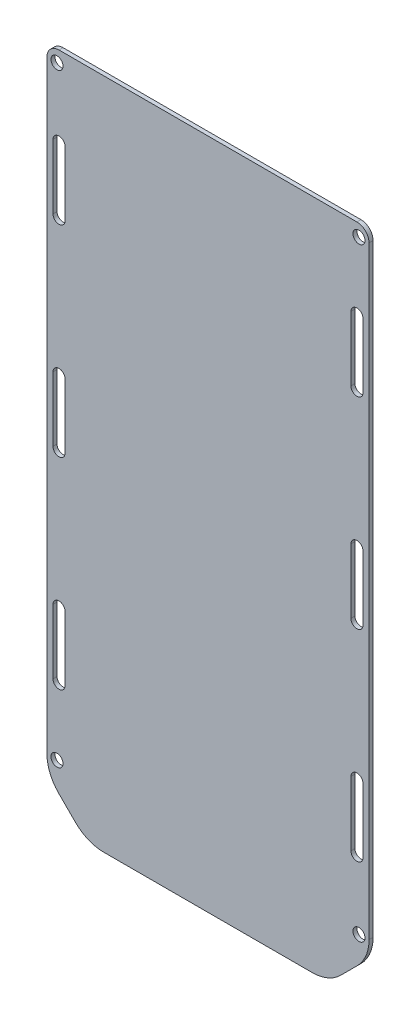
from build123d import *

# Parameters (mm, degrees)
SKETCH2_R           = 1.5
BOSS_EXTRUDE1_DEPTH = 1


with BuildPart() as part:
    # Sketch2 → Boss-Extrude1 (new body)
    with BuildSketch(Plane.XY):
        with BuildLine():
            Line((-35.857864376, -93), (15.857864376, -93))
            ThreePointArc((15.857864376, -93), (19.6846987, -92.238795325), (22.928932188, -90.071067812))
            Line((22.928932188, -90.071067812), (27.071067812, -85.928932188))
            ThreePointArc((27.071067812, -85.928932188), (29.238795325, -82.6846987), (30, -78.857864376))
            Line((30, -78.857864376), (30, 71))
            ThreePointArc((30, 71), (29.121320344, 73.121320344), (27, 74))
            Line((27, 74), (-47, 74))
            ThreePointArc((-47, 74), (-49.121320344, 73.121320344), (-50, 71))
            Line((-50, 71), (-50, -78.857864376))
            ThreePointArc((-50, -78.857864376), (-49.238795325, -82.6846987), (-47.071067812, -85.928932188))
            Line((-47.071067812, -85.928932188), (-42.928932188, -90.071067812))
            ThreePointArc((-42.928932188, -90.071067812), (-39.6846987, -92.238795325), (-35.857864376, -93))
        make_face()
        with Locations((-47.5, 71)):
            Circle(SKETCH2_R, mode=Mode.SUBTRACT)
        with Locations((27.5, 71)):
            Circle(SKETCH2_R, mode=Mode.SUBTRACT)
        with Locations((-47.5, -79)):
            Circle(SKETCH2_R, mode=Mode.SUBTRACT)
        with Locations((27.5, -79)):
            Circle(SKETCH2_R, mode=Mode.SUBTRACT)
        with BuildLine():
            Line((-48.5, -12), (-48.5, 4))
            ThreePointArc((-48.5, 4), (-47, 5.5), (-45.5, 4))
            Line((-45.5, 4), (-45.5, -12))
            ThreePointArc((-45.5, -12), (-47, -13.5), (-48.5, -12))
        make_face(mode=Mode.SUBTRACT)
        with BuildLine():
            Line((28.5, -12), (28.5, 4))
            ThreePointArc((28.5, 4), (27, 5.5), (25.5, 4))
            Line((25.5, 4), (25.5, -12))
            ThreePointArc((25.5, -12), (27, -13.5), (28.5, -12))
        make_face(mode=Mode.SUBTRACT)
        with BuildLine():
            Line((-48.5, 38), (-48.5, 54))
            ThreePointArc((-48.5, 54), (-47, 55.5), (-45.5, 54))
            Line((-45.5, 54), (-45.5, 38))
            ThreePointArc((-45.5, 38), (-47, 36.5), (-48.5, 38))
        make_face(mode=Mode.SUBTRACT)
        with BuildLine():
            Line((-45.5, -46), (-45.5, -62))
            ThreePointArc((-45.5, -62), (-47, -63.5), (-48.5, -62))
            Line((-48.5, -62), (-48.5, -46))
            ThreePointArc((-48.5, -46), (-47, -44.5), (-45.5, -46))
        make_face(mode=Mode.SUBTRACT)
        with BuildLine():
            Line((28.5, 38), (28.5, 54))
            ThreePointArc((28.5, 54), (27, 55.5), (25.5, 54))
            Line((25.5, 54), (25.5, 38))
            ThreePointArc((25.5, 38), (27, 36.5), (28.5, 38))
        make_face(mode=Mode.SUBTRACT)
        with BuildLine():
            Line((25.5, -46), (25.5, -62))
            ThreePointArc((25.5, -62), (27, -63.5), (28.5, -62))
            Line((28.5, -62), (28.5, -46))
            ThreePointArc((28.5, -46), (27, -44.5), (25.5, -46))
        make_face(mode=Mode.SUBTRACT)
    extrude(amount=BOSS_EXTRUDE1_DEPTH)


solid = part.part
